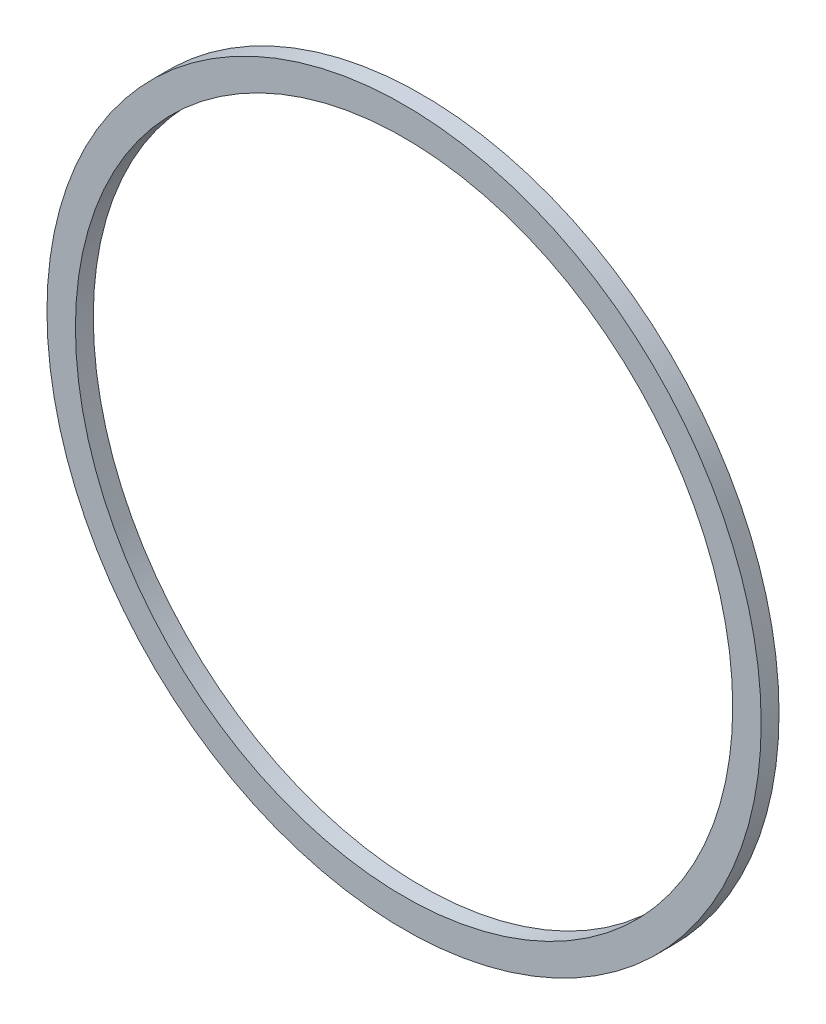
from build123d import *

# Parameters (mm, degrees)
SKETCH1_R           = 127
SKETCH1_R_2         = 116.88
BOSS_EXTRUDE1_DEPTH = 6.35


with BuildPart() as part:
    # Sketch1 → Boss-Extrude1 (new body)
    with BuildSketch(Plane.XY):
        Circle(SKETCH1_R)
        Circle(SKETCH1_R_2, mode=Mode.SUBTRACT)
    extrude(amount=BOSS_EXTRUDE1_DEPTH)


solid = part.part
